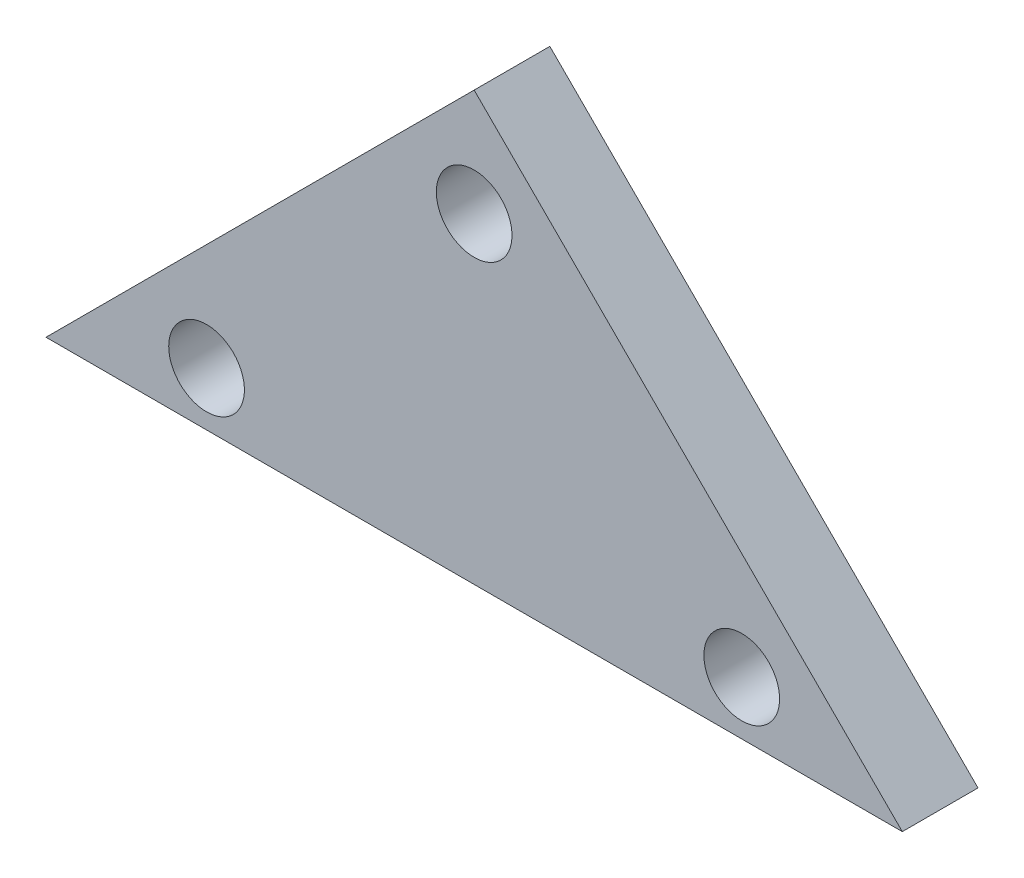
from build123d import *

# Parameters (mm, degrees)
SKETCH1_R           = 2.38125
BOSS_EXTRUDE1_DEPTH = 4.7625


with BuildPart() as part:
    # Sketch1 → Boss-Extrude1 (new body)
    with BuildSketch(Plane.XY):
        Polygon((-26.940768363, -20.205576272), (26.940768363, -20.205576272), (0, 6.735192091), align=None)
        with Locations(Location((0, 0, 0), (0, 0, 180))):
            Circle(SKETCH1_R, mode=Mode.SUBTRACT)
        with Locations(Location((-16.837980227, -16.837980227, 0), (0, 0, 180))):
            Circle(SKETCH1_R, mode=Mode.SUBTRACT)
        with Locations(Location((16.837980227, -16.837980227, 0), (0, 0, 180))):
            Circle(SKETCH1_R, mode=Mode.SUBTRACT)
    extrude(amount=BOSS_EXTRUDE1_DEPTH)


solid = part.part
